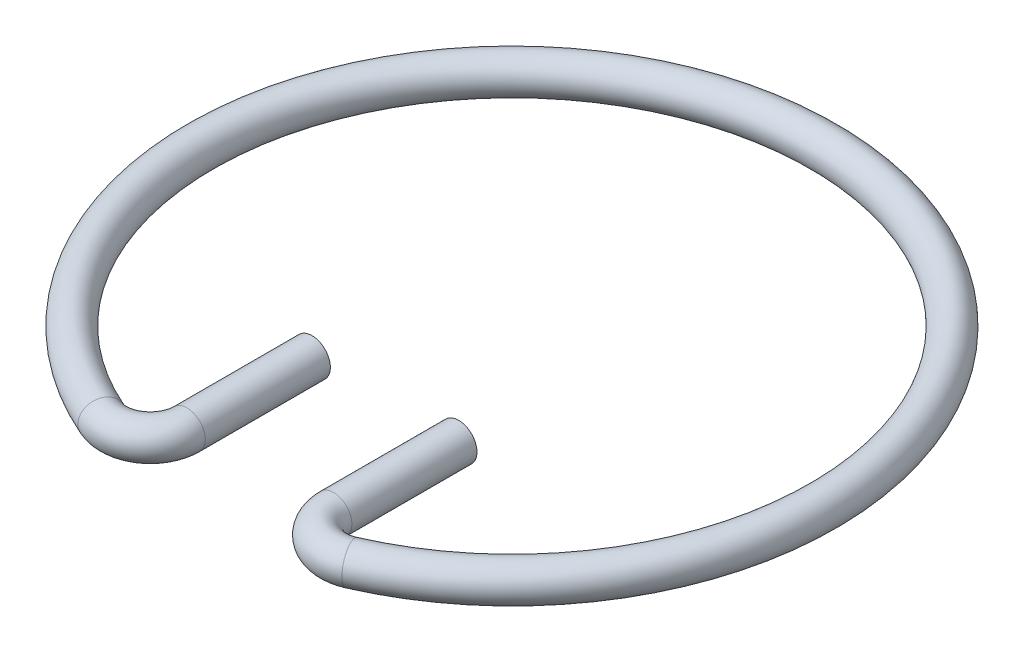
from build123d import *

# Parameters (mm, degrees)
SKETCH1_R = 0.79375


with BuildPart() as part:
    # Sweep1: sweep along a path in Sketch3
    with BuildLine(Plane(origin=(0, 0, 0), x_dir=(1, 0, 0), z_dir=(0, 1, 0))) as sweep1_path:
        Line((0, 0), (0, -5.416564986))
        ThreePointArc((0, -5.416564986), (-0.718299984, -6.74496537), (-2.223178057, -6.871236652))
        ThreePointArc((-2.223178057, -6.871236652), (3.175, 18.962885143), (8.573178057, -6.871236652))
        ThreePointArc((8.573178057, -6.871236652), (7.068299984, -6.74496537), (6.35, -5.416564986))
        Line((6.35, -5.416564986), (6.35, 0))
    # Sketch1 → Sweep1 (sweep)
    with BuildSketch(Plane.XY):
        Circle(SKETCH1_R)
    sweep(path=sweep1_path.line)


solid = part.part
